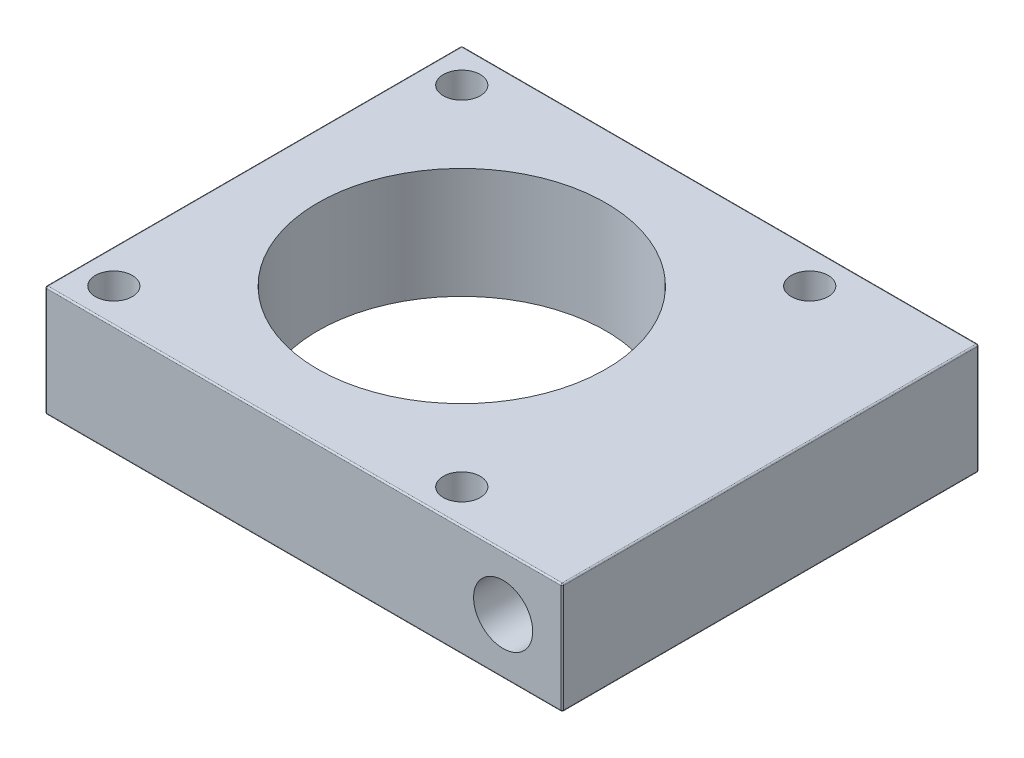
from build123d import *

# Parameters (mm, degrees)
SKETCH1_W           = 70
SKETCH1_H           = 15
SKETCH1_R           = 4
BOSS_EXTRUDE1_DEPTH = 56.4
SKETCH2_R           = 19.5
CUT_EXTRUDE1_DEPTH  = 42.3
SKETCH3_R           = 2.5
CUT_EXTRUDE2_DEPTH  = 92.137039671
FILLET1_R           = 0.2


with BuildPart() as part:
    # Sketch1 → Boss-Extrude1 (new body)
    with BuildSketch(Plane.XY):
        with Locations((35, 7.5)):
            Rectangle(SKETCH1_W, SKETCH1_H)
        with Locations((62, 7.5)):
            Circle(SKETCH1_R, mode=Mode.SUBTRACT)
    extrude(amount=BOSS_EXTRUDE1_DEPTH)

    # Sketch2 → Cut-Extrude1 (cut)
    with BuildSketch(Plane(origin=(0, 15, 0), x_dir=(1, 0, 0), z_dir=(0, 1, 0))):
        with Locations(Location((28.2, -28.2, 0), (0, 0, 270))):
            Circle(SKETCH2_R)
    extrude(amount=-CUT_EXTRUDE1_DEPTH, mode=Mode.SUBTRACT)

    # Sketch3 → Cut-Extrude2 (cut, through all)
    with BuildSketch(Plane(origin=(0, 0, 0), x_dir=(-1, 0, 0), z_dir=(0, -1, 0))):
        with Locations(Location((-51.75, -4.65, 0), (0, 0, 90))):
            Circle(SKETCH3_R)
        with Locations(Location((-4.65, -4.65, 0), (0, 0, 90))):
            Circle(SKETCH3_R)
        with Locations(Location((-4.65, -51.75, 0), (0, 0, 90))):
            Circle(SKETCH3_R)
        with Locations(Location((-51.75, -51.75, 0), (0, 0, 90))):
            Circle(SKETCH3_R)
    extrude(amount=-CUT_EXTRUDE2_DEPTH, mode=Mode.SUBTRACT)

    # Fillet1
    fillet1_edges = [part.edges().sort_by_distance(p)[0] for p in [
        (70, 7.5, 56.4),
        (35, 15, 56.4),
        (0, 7.5, 56.4),
        (35, 15, 0),
        (70, 7.5, 0),
        (35, 0, 0),
        (0, 7.5, 0),
        (35, 0, 56.4),
        (0, 15, 28.2),
        (70, 15, 28.2),
        (70, 0, 28.2),
        (0, 0, 28.2),
    ]]
    fillet(fillet1_edges, radius=FILLET1_R)


solid = part.part
